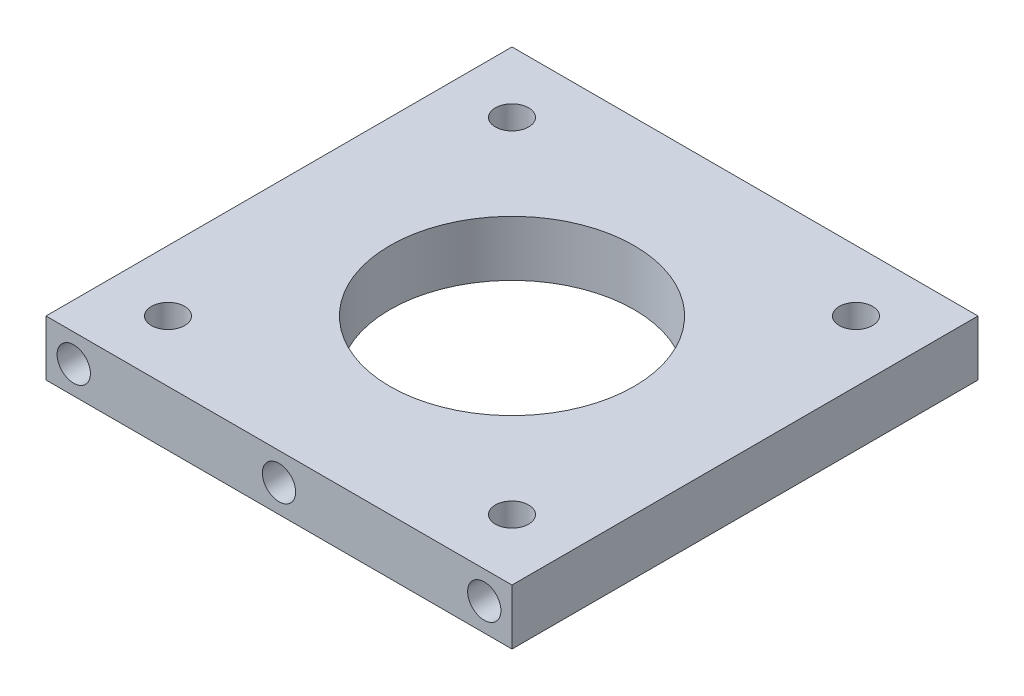
from build123d import *

# Parameters (mm, degrees)
SKETCH_1_W          = 42
SKETCH_1_H          = 42
EXTRUDE_1_DEPTH     = 5
SKETCH_3_R          = 11
SKETCH_3_R_2        = 1.5
CUT_EXTRUDE_1_DEPTH = 31.116440693
SKETCH_2_R          = 1.5
CUT_EXTRUDE_3_DEPTH = 4


with BuildPart() as part:
    # 스케치1 → 보스-돌출1 (new body)
    with BuildSketch(Plane(origin=(0, 0, 0), x_dir=(1, 0, 0), z_dir=(0, 1, 0))):
        Rectangle(SKETCH_1_W, SKETCH_1_H)
    extrude(amount=EXTRUDE_1_DEPTH)

    # 스케치3 → 컷-돌출1 (cut, through all)
    with BuildSketch(Plane(origin=(0, 5, 0), x_dir=(1, 0, 0), z_dir=(0, 1, 0))):
        with Locations(Location((0, 0, 0), (0, 0, 270))):
            Circle(SKETCH_3_R)
        with Locations(Location((-15.5, 15.5, 0), (0, 0, 270))):
            Circle(SKETCH_3_R_2)
        with Locations(Location((15.499999997, 15.49956129, 0), (0, 0, 270))):
            Circle(SKETCH_3_R_2)
        with Locations(Location((15.499561287, -15.500438707, 0), (0, 0, 270))):
            Circle(SKETCH_3_R_2)
        with Locations(Location((-15.50043871, -15.499999997, 0), (0, 0, 270))):
            Circle(SKETCH_3_R_2)
    extrude(amount=-CUT_EXTRUDE_1_DEPTH, mode=Mode.SUBTRACT)

    # 스케치2 → 컷-돌출3 (cut)
    with BuildSketch(Plane.XY.offset(21)):
        with Locations((-18.5, 2.5)):
            Circle(SKETCH_2_R)
        with Locations((18.5, 2.5)):
            Circle(SKETCH_2_R)
        with Locations((0, 2.5)):
            Circle(SKETCH_2_R)
    extrude(amount=-CUT_EXTRUDE_3_DEPTH, mode=Mode.SUBTRACT)


solid = part.part
